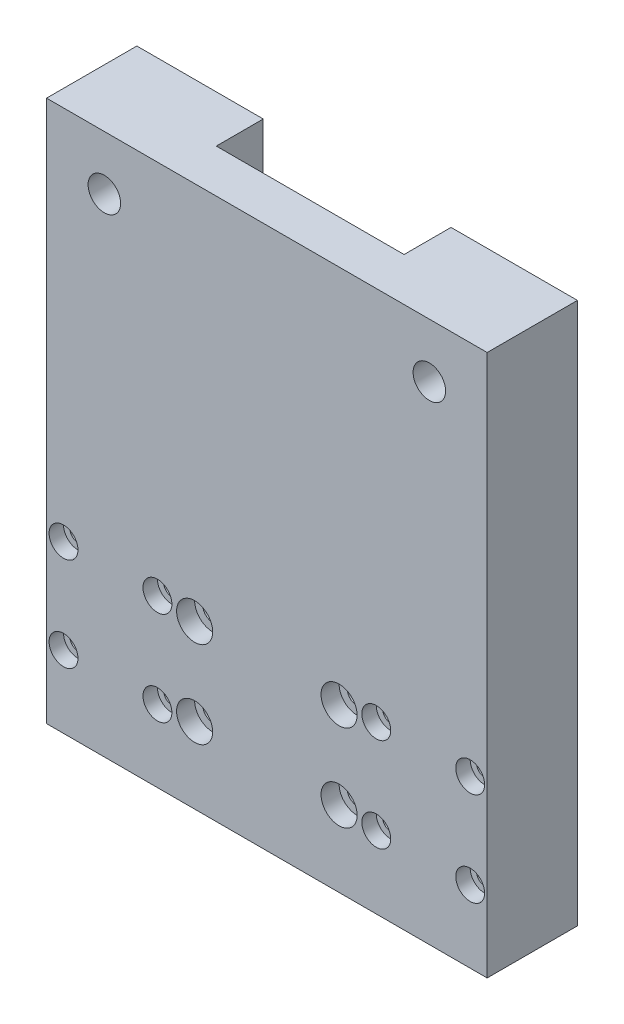
from build123d import *

# Parameters (mm, degrees)
SKETCH1_W                      = 122
SKETCH1_H                      = 150
BOSS_EXTRUDE1_DEPTH            = 25
CBORE_FOR_M4_SHCS1_D           = 4.5
CBORE_FOR_M4_SHCS1_CBORE_D     = 8
CBORE_FOR_M4_SHCS1_CBORE_DEPTH = 4
SKETCH4_W                      = 52
SKETCH4_H                      = 13
CUT_EXTRUDE1_DEPTH             = 195.958970042
CBORE_FOR_M5_SHCS1_D           = 5.5
CBORE_FOR_M5_SHCS1_CBORE_D     = 10
CBORE_FOR_M5_SHCS1_CBORE_DEPTH = 5
CBORE_FOR_M8_SHCS1_D           = 9
CBORE_FOR_M8_SHCS1_CBORE_D     = 15
CBORE_FOR_M8_SHCS1_CBORE_DEPTH = 8


with BuildPart() as part:
    # Sketch1 → Boss-Extrude1 (new body)
    with BuildSketch(Plane.XY):
        with Locations((61, 75)):
            Rectangle(SKETCH1_W, SKETCH1_H)
    extrude(amount=BOSS_EXTRUDE1_DEPTH)

    # CBORE for M4 SHCS1 (through all)
    with Locations(Plane(origin=(4.7, 46, 25), x_dir=(1, 0, 0), z_dir=(0, 0, 1))):
        with Locations((0, 0), (26, 0), (0, -26), (26, -26), (86.6, 0), (112.6, 0), (112.6, -26), (86.6, -26)):
            CounterBoreHole(CBORE_FOR_M4_SHCS1_D / 2, CBORE_FOR_M4_SHCS1_CBORE_D / 2, CBORE_FOR_M4_SHCS1_CBORE_DEPTH)

    # Sketch4 → Cut-Extrude1 (cut, through all)
    with BuildSketch(Plane(origin=(0, 0, 0), x_dir=(1, 0, 0), z_dir=(0, 1, 0))):
        with Locations((61, -6.5)):
            Rectangle(SKETCH4_W, SKETCH4_H)
    extrude(amount=CUT_EXTRUDE1_DEPTH, mode=Mode.SUBTRACT)

    # CBORE for M5 SHCS1 (through all)
    with Locations(Plane(origin=(41, 45, 25), x_dir=(1, 0, 0), z_dir=(0, 0, 1))):
        with Locations((0, 0), (40, 0), (40, -24), (0, -24)):
            CounterBoreHole(CBORE_FOR_M5_SHCS1_D / 2, CBORE_FOR_M5_SHCS1_CBORE_D / 2, CBORE_FOR_M5_SHCS1_CBORE_DEPTH)

    # CBORE for M8 SHCS1 (through all)
    with Locations(Plane(origin=(106, 135, 0), x_dir=(-1, 0, 0), z_dir=(0, 0, -1))):
        with Locations((0, 0), (90, 0)):
            CounterBoreHole(CBORE_FOR_M8_SHCS1_D / 2, CBORE_FOR_M8_SHCS1_CBORE_D / 2, CBORE_FOR_M8_SHCS1_CBORE_DEPTH)


solid = part.part
